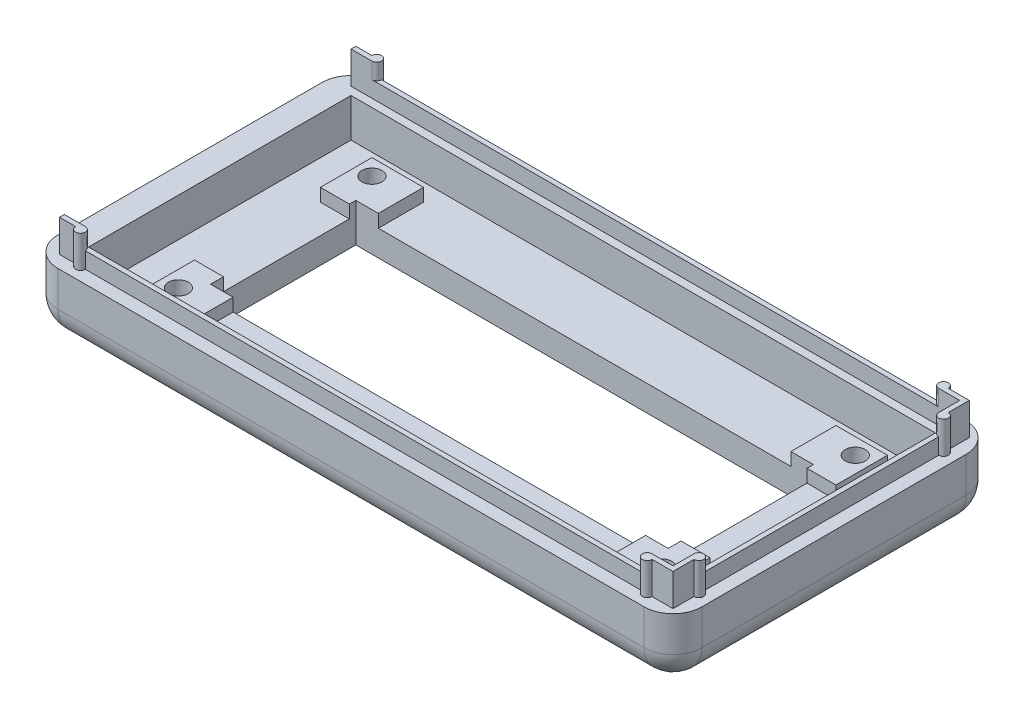
from build123d import *

# Parameters (mm, degrees)
SKETCH_1_W          = 100
SKETCH_1_H          = 50
EXTRUDE_1_DEPTH     = 10
SHELL_1_T           = -4
FILLET_1_R          = 4.5
SKETCH_2_W          = 71.05
SKETCH_2_H          = 22.55
CUT_EXTRUDE_1_DEPTH = 4.5
EXTRUDE_3_DEPTH     = 2
SKETCH_7_R          = 1.55
CUT_EXTRUDE_2_DEPTH = 4
EXTRUDE_5_DEPTH     = 5
EXTRUDE_6_DEPTH     = 2.5


with BuildPart() as part:
    # Эскиз1 → Бобышка-Вытянуть1 (new body)
    with BuildSketch(Plane(origin=(0, 0, 0), x_dir=(1, 0, 0), z_dir=(0, 1, 0))):
        with Locations((50, -25)):
            Rectangle(SKETCH_1_W, SKETCH_1_H)
    extrude(amount=EXTRUDE_1_DEPTH)

    # Оболочка1
    shell_1_openings = [part.faces().sort_by_distance(p)[0] for p in [
        (50, 10, 25),
    ]]
    offset(amount=SHELL_1_T, openings=shell_1_openings, kind=Kind.INTERSECTION)

    # Скругление1
    fillet_1_edges = [part.edges().sort_by_distance(p)[0] for p in [
        (50, 0, 50),
        (100, 0, 25),
        (50, 0, 0),
        (0, 0, 25),
        (100, 5, 0),
        (100, 5, 50),
        (0, 5, 0),
        (0, 5, 50),
    ]]
    fillet(fillet_1_edges, radius=FILLET_1_R)

    # Эскиз2 → Вырез-Вытянуть1 (cut)
    with BuildSketch(Plane(origin=(0, 0, 0), x_dir=(-1, 0, 0), z_dir=(0, -1, 0))):
        with Locations((-50, -25)):
            Rectangle(SKETCH_2_W, SKETCH_2_H)
    extrude(amount=-CUT_EXTRUDE_1_DEPTH, mode=Mode.SUBTRACT)

    # Эскиз6 → Бобышка-Вытянуть3 (add)
    with BuildSketch(Plane(origin=(0, 4, 0), x_dir=(1, 0, 0), z_dir=(0, 1, 0))):
        Polygon((14.475, -13.725), (14.475, -14.725), (9.975, -14.725), (9.975, -6.725), (17.975, -6.725), (17.975, -13.725), align=None)
        Polygon((14.475, -36.275), (14.475, -34.275), (9.975, -34.275), (9.975, -41.775), (17.975, -41.775), (17.975, -36.275), align=None)
        Polygon((90.025, -41.775), (82.025, -41.775), (82.025, -36.275), (85.525, -36.275), (85.525, -34.275), (90.025, -34.275), align=None)
        Polygon((82.025, -6.725), (82.025, -13.725), (85.525, -13.725), (85.525, -14.725), (90.025, -14.725), (90.025, -6.725), align=None)
    extrude(amount=EXTRUDE_3_DEPTH)

    # Эскиз7 → Вырез-Вытянуть2 (cut)
    with BuildSketch(Plane(origin=(0, 6, 0), x_dir=(1, 0, 0), z_dir=(0, 1, 0))):
        with Locations((12.475, -9.225)):
            Circle(SKETCH_7_R)
        with Locations((87.525, -9.225)):
            Circle(SKETCH_7_R)
        with Locations((12.475, -39.275)):
            Circle(SKETCH_7_R)
        with Locations((87.525, -39.275)):
            Circle(SKETCH_7_R)
    extrude(amount=-CUT_EXTRUDE_2_DEPTH, mode=Mode.SUBTRACT)

    # Эскиз8 → Бобышка-Вытянуть5 (add)
    with BuildSketch(Plane(origin=(0, 10, 0), x_dir=(1, 0, 0), z_dir=(0, 1, 0))):
        with BuildLine():
            Line((5.25, -2), (2.75, -2))
            Line((2.75, -2), (2.75, -2.75))
            Line((2.75, -2.75), (6, -2.75))
            ThreePointArc((6, -2.75), (6.530330086, -1.469669914), (5.25, -2))
        make_face()
        with BuildLine():
            Line((6, -47.25), (2.75, -47.25))
            Line((2.75, -47.25), (2.75, -48))
            Line((2.75, -48), (5.25, -48))
            ThreePointArc((5.25, -48), (6.530330086, -48.530330086), (6, -47.25))
        make_face()
        with BuildLine():
            Line((98, -2), (94.75, -2))
            ThreePointArc((94.75, -2), (93.469669914, -1.469669914), (94, -2.75))
            Line((94, -2.75), (97.25, -2.75))
            Line((97.25, -2.75), (97.25, -6))
            ThreePointArc((97.25, -6), (98.530330086, -6.530330086), (98, -5.25))
            Line((98, -5.25), (98, -2))
        make_face()
        with BuildLine():
            Line((97.25, -47.25), (94, -47.25))
            ThreePointArc((94, -47.25), (93.469669914, -48.530330086), (94.75, -48))
            Line((94.75, -48), (98, -48))
            Line((98, -48), (98, -44.75))
            ThreePointArc((98, -44.75), (98.530330086, -43.469669914), (97.25, -44))
            Line((97.25, -44), (97.25, -47.25))
        make_face()
    extrude(amount=EXTRUDE_5_DEPTH)

    # Эскиз8<4> → Бобышка-Вытянуть6 (add)
    with BuildSketch(Plane(origin=(0, 10, 0), x_dir=(1, 0, 0), z_dir=(0, 1, 0))):
        with BuildLine():
            ThreePointArc((6.75, -2), (6.530330086, -2.530330086), (6, -2.75))
            Line((6, -2.75), (94, -2.75))
            ThreePointArc((94, -2.75), (93.469669914, -2.530330086), (93.25, -2))
            Line((93.25, -2), (6.75, -2))
        make_face()
        with BuildLine():
            Line((94, -47.25), (6, -47.25))
            ThreePointArc((6, -47.25), (6.530330086, -47.469669914), (6.75, -48))
            Line((6.75, -48), (93.25, -48))
            ThreePointArc((93.25, -48), (93.469669914, -47.469669914), (94, -47.25))
        make_face()
        with BuildLine():
            ThreePointArc((98, -6.75), (97.469669914, -6.530330086), (97.25, -6))
            Line((97.25, -6), (97.25, -44))
            ThreePointArc((97.25, -44), (97.469669914, -43.469669914), (98, -43.25))
            Line((98, -43.25), (98, -6.75))
        make_face()
    extrude(amount=EXTRUDE_6_DEPTH)


solid = part.part
